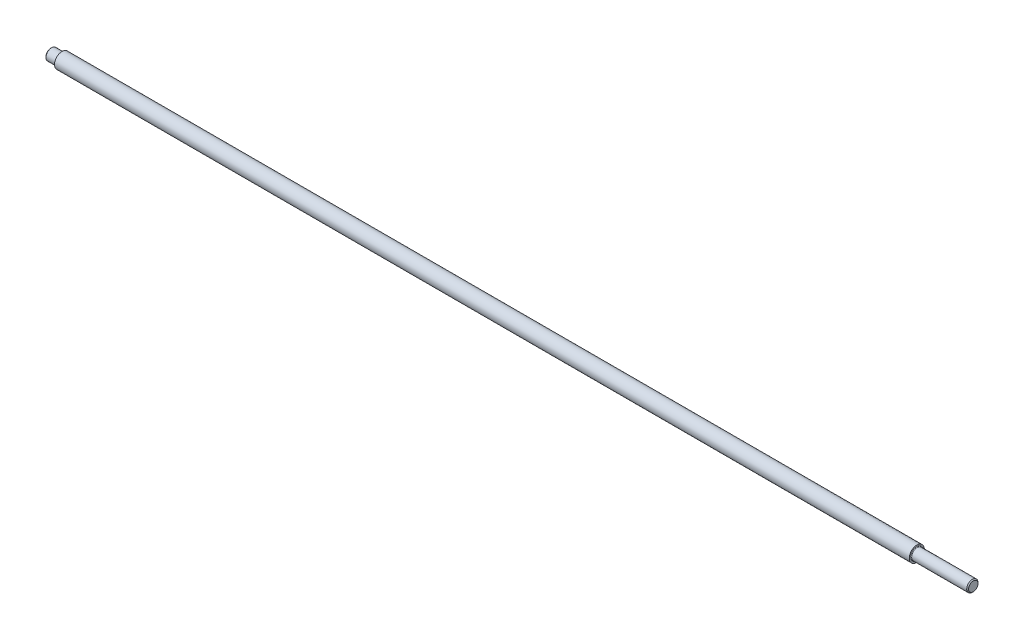
from build123d import *


with BuildPart() as part:
    # Sketch1 → Revolve1 (revolve)
    with BuildSketch(Plane.XY, mode=Mode.PRIVATE) as revolve1_sk:
        with BuildLine():
            Line((0, 2.5), (0, 0))
            Line((0, 0), (490, 0))
            Line((490, 0), (490, 2.5))
            Line((490, 2.5), (489.5, 3))
            Line((489.5, 3), (460.3, 3))
            ThreePointArc((460.3, 3), (460.087867966, 3.087867966), (460, 3.3))
            Line((460, 3.3), (460, 4))
            Line((460, 4), (6, 4))
            Line((6, 4), (6, 3.3))
            ThreePointArc((6, 3.3), (5.912132034, 3.087867966), (5.7, 3))
            Line((5.7, 3), (0.5, 3))
            Line((0.5, 3), (0, 2.5))
        make_face()
    revolve(revolve1_sk.sketch.rotate(Axis((0, 0, 0), (1, 0, 0)), 270), axis=Axis((0, 0, 0), (1, 0, 0)))


solid = part.part
